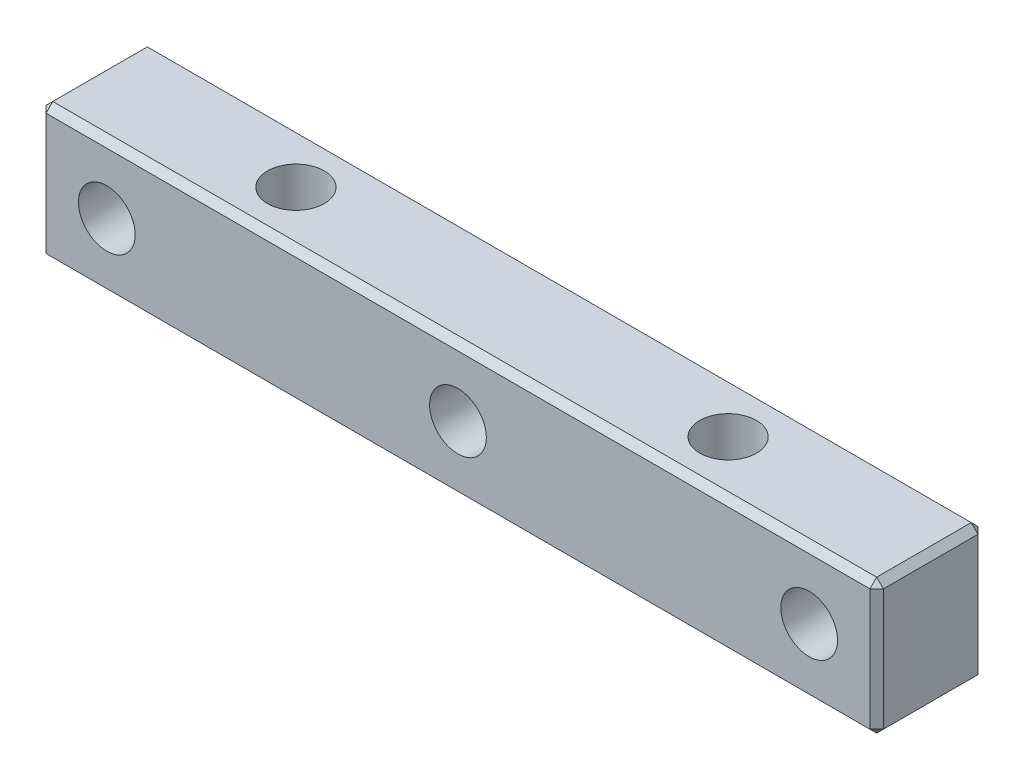
from build123d import *

# Parameters (mm, degrees)
SKETCH_2_W         = 62
SKETCH_2_H         = 10
SKETCH_2_R         = 0.5
EXTRUDE_1_DEPTH    = 4
HOLE_WIZARD_M5_1_D = 4.2
HOLE_WIZARD_M5_2_D = 4.2
CHAMFER_1_SIZE     = 0.5


with BuildPart() as part:
    # 草图2 → 凸台-拉伸1 (new, symmetric)
    with BuildSketch(Plane.XY):
        Rectangle(SKETCH_2_W, SKETCH_2_H)
        with Locations((-26, 0)):
            Circle(SKETCH_2_R, mode=Mode.SUBTRACT)
        with Locations((26, 0)):
            Circle(SKETCH_2_R, mode=Mode.SUBTRACT)
    extrude(amount=EXTRUDE_1_DEPTH, both=True)

    # M5 螺纹孔1 (through all)
    with Locations(Plane.XY.offset(4)):
        with Locations((0, 0), (-26, 0), (26, 0)):
            Hole(HOLE_WIZARD_M5_1_D / 2)

    # M5 螺纹孔2 (through all)
    with Locations(Plane(origin=(0, 5, 0), x_dir=(1, 0, 0), z_dir=(0, 1, 0))):
        with Locations((16, 0), (-16, 0)):
            Hole(HOLE_WIZARD_M5_2_D / 2)

    # 倒角1
    chamfer_1_edges = [part.edges().sort_by_distance(p)[0] for p in [
        (0, -5, 4),
        (31, 0, 4),
        (0, 5, 4),
        (31, 0, -4),
        (0, -5, -4),
        (-31, 0, -4),
        (0, 5, -4),
        (-31, 0, 4),
        (31, 5, 0),
        (31, -5, 0),
        (-31, -5, 0),
        (-31, 5, 0),
    ]]
    chamfer(chamfer_1_edges, length=CHAMFER_1_SIZE)


solid = part.part
